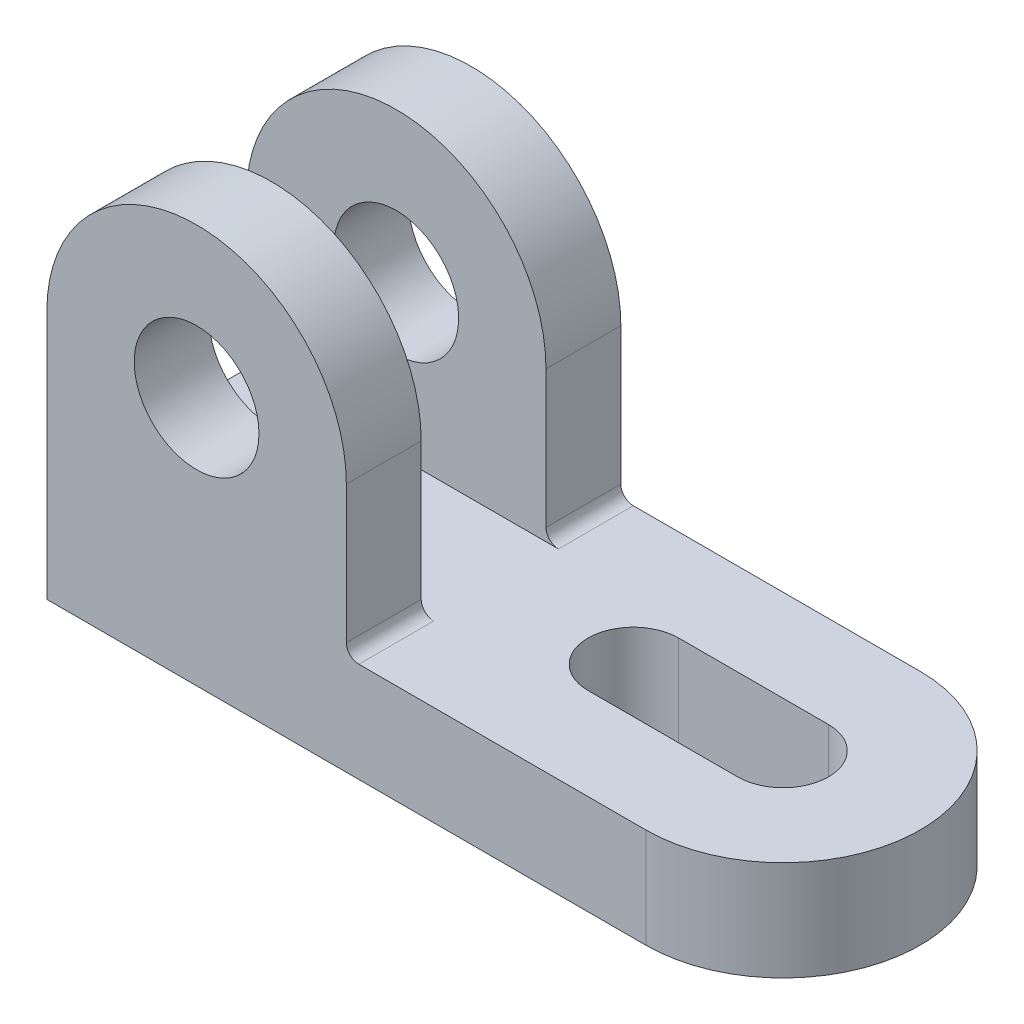
from build123d import *

# Parameters (mm, degrees)
BOSS_EXTRUDE1_DEPTH = 16
CUT_EXTRUDE2_DEPTH  = 16
SKETCH3_R           = 10
BOSS_EXTRUDE2_DEPTH = 12
BOSS_EXTRUDE3_START = -12
SKETCH11_R          = 10
BOSS_EXTRUDE3_DEPTH = 12
FILLET1_R           = 2
FILLET2_R           = 2


with BuildPart() as part:
    # Sketch1 → Boss-Extrude1 (new body)
    with BuildSketch(Plane(origin=(0, 0, 0), x_dir=(1, 0, 0), z_dir=(0, 1, 0))):
        with BuildLine():
            Line((-48, 22), (48, 22))
            ThreePointArc((48, 22), (70, 0), (48, -22))
            Line((48, -22), (-48, -22))
            Line((-48, -22), (-48, 22))
        make_face()
    extrude(amount=BOSS_EXTRUDE1_DEPTH)

    # Sketch2 → Cut-Extrude2 (cut)
    with BuildSketch(Plane(origin=(0, 0, 0), x_dir=(1, 0, 0), z_dir=(0, 1, 0))):
        with BuildLine():
            Line((48, -7.276334806), (24, -7.276334806))
            ThreePointArc((24, -7.276334806), (16.723665194, 0), (24, 7.276334806))
            Line((24, 7.276334806), (48, 7.276334806))
            ThreePointArc((48, 7.276334806), (55.276334806, 0), (48, -7.276334806))
        make_face()
    extrude(amount=CUT_EXTRUDE2_DEPTH, mode=Mode.SUBTRACT)

    # Sketch3 → Boss-Extrude2 (add)
    with BuildSketch(Plane.XY.offset(22)):
        with BuildLine():
            Line((-48, 40), (-48, 16))
            Line((-48, 16), (0, 16))
            Line((0, 16), (0, 40))
            ThreePointArc((0, 40), (-24, 64), (-48, 40))
        make_face()
        with Locations((-24, 40)):
            Circle(SKETCH3_R, mode=Mode.SUBTRACT)
    extrude(amount=-BOSS_EXTRUDE2_DEPTH)

    # Sketch11 → Boss-Extrude3 (add)
    with BuildSketch(Plane(origin=(0, 0, -22), x_dir=(-1, 0, 0), z_dir=(0, 0, -1)).offset(BOSS_EXTRUDE3_START)):
        with BuildLine():
            Line((0, 16), (48, 16))
            Line((48, 16), (48, 40))
            ThreePointArc((48, 40), (24, 64), (0, 40))
            Line((0, 40), (0, 16))
        make_face()
        with Locations(Location((24, 40, 0), (0, 0, 180))):
            Circle(SKETCH11_R, mode=Mode.SUBTRACT)
    extrude(amount=BOSS_EXTRUDE3_DEPTH)

    # Fillet1
    fillet1_edges = [part.edges().sort_by_distance(p)[0] for p in [
        (0, 16, 16),
    ]]
    fillet(fillet1_edges, radius=FILLET1_R)

    # Fillet2
    fillet2_edges = [part.edges().sort_by_distance(p)[0] for p in [
        (0, 16, -16),
    ]]
    fillet(fillet2_edges, radius=FILLET2_R)


solid = part.part
